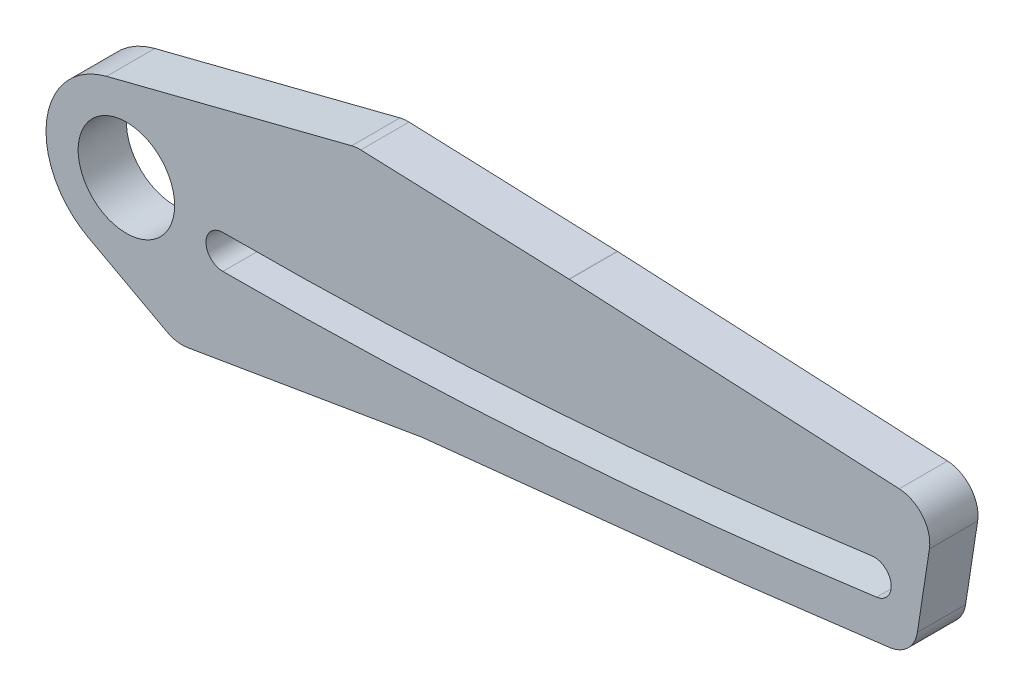
from build123d import *

# Parameters (mm, degrees)
SKETCH_1_R          = 3
EXTRUDE_1_DEPTH     = 1.5
CUT_EXTRUDE_1_DEPTH = 22
FILLET_1_R          = 2


with BuildPart() as part:
    # 草图1 → 凸台-拉伸1 (new, symmetric)
    with BuildSketch(Plane.XY):
        with BuildLine():
            Line((-1.233702436, 4.84540796), (14.292269552, 8.798517714))
            Line((14.292269552, 8.798517714), (27.541816671, 8.302545362))
            Line((27.541816671, 8.302545362), (50.285691672, 7.168894271))
            Line((50.285691672, 7.168894271), (48.971743891, -1.387225717))
            Line((48.971743891, -1.387225717), (38.114277377, -2.724152564))
            Line((38.114277377, -2.724152564), (18.384478153, -4.790312237))
            Line((18.384478153, -4.790312237), (3.124153733, -7.364758207))
            Line((3.124153733, -7.364758207), (-2.372822781, -4.401103504))
            ThreePointArc((-2.372822781, -4.401103504), (-4.962484216, 0.611351292), (-1.233702436, 4.84540796))
        make_face()
        Circle(SKETCH_1_R, mode=Mode.SUBTRACT)
    extrude(amount=EXTRUDE_1_DEPTH, both=True)

    # 草图2 → 切除-拉伸1 (cut)
    with BuildSketch(Plane.XY.offset(1.5)):
        with BuildLine():
            ThreePointArc((6, -2.05), (26.381158068, -1.352479883), (46.666940766, 0.736816365))
            ThreePointArc((46.666940766, 0.736816365), (47.563889378, 1.920236488), (46.380469254, 2.8171851))
            ThreePointArc((46.380469254, 2.8171851), (26.237586384, 0.742606553), (6, 0.05))
            ThreePointArc((6, 0.05), (4.95, -1), (6, -2.05))
        make_face()
    extrude(amount=-CUT_EXTRUDE_1_DEPTH, mode=Mode.SUBTRACT)

    # 圆角1
    fillet_1_edges = [part.edges().sort_by_distance(p)[0] for p in [
        (14.292269552, 8.798517714, 0),
        (27.541816671, 8.302545362, 0),
        (50.285691672, 7.168894271, 0),
        (48.971743891, -1.387225717, 0),
        (38.114277377, -2.724152564, 0),
        (18.384478153, -4.790312237, 0),
        (3.124153733, -7.364758207, 0),
    ]]
    fillet(fillet_1_edges, radius=FILLET_1_R)


solid = part.part
